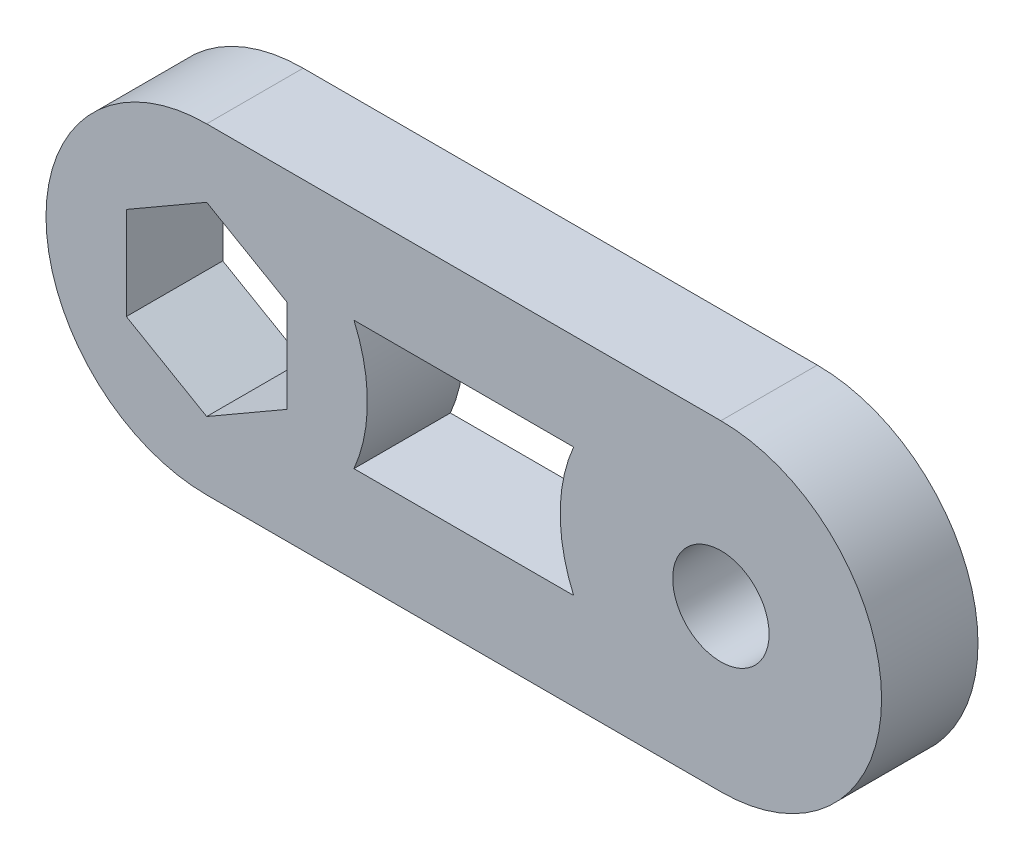
from build123d import *

# Parameters (mm, degrees)
SKETCH1_R          = 1.5
EXTRUDE1_DEPTH     = 3
CUT_EXTRUDE1_START = -10
SKETCH2_R          = 1.5
CUT_EXTRUDE1_DEPTH = 10


with BuildPart() as part:
    # Sketch1 → Extrude1 (new body)
    with BuildSketch(Plane.XY):
        with BuildLine():
            Line((0, -5), (16, -5))
            ThreePointArc((16, -5), (21, 0), (16, 5))
            Line((16, 5), (0, 5))
            ThreePointArc((0, 5), (-5, 0), (0, -5))
        make_face()
        with Locations((16, 0)):
            Circle(SKETCH1_R, mode=Mode.SUBTRACT)
        Circle(SKETCH1_R, mode=Mode.SUBTRACT)
    extrude(amount=EXTRUDE1_DEPTH)

    # Sketch2 → Cut-Extrude1 (cut)
    with BuildSketch(Plane.XY.offset(3).offset(CUT_EXTRUDE1_START)):
        with Locations((16, 0)):
            Circle(SKETCH2_R)
        Polygon((0, 2.886751346), (-2.5, 1.443375673), (-2.5, -1.443375673), (0, -2.886751346), (2.5, -1.443375673), (2.5, 1.443375673), align=None)
        with BuildLine():
            Line((4.582575695, -2), (11.417424305, -2))
            ThreePointArc((11.417424305, -2), (11, 0), (11.417424305, 2))
            Line((11.417424305, 2), (4.582575695, 2))
            ThreePointArc((4.582575695, 2), (5, 0), (4.582575695, -2))
        make_face()
    extrude(amount=CUT_EXTRUDE1_DEPTH, mode=Mode.SUBTRACT)


solid = part.part
